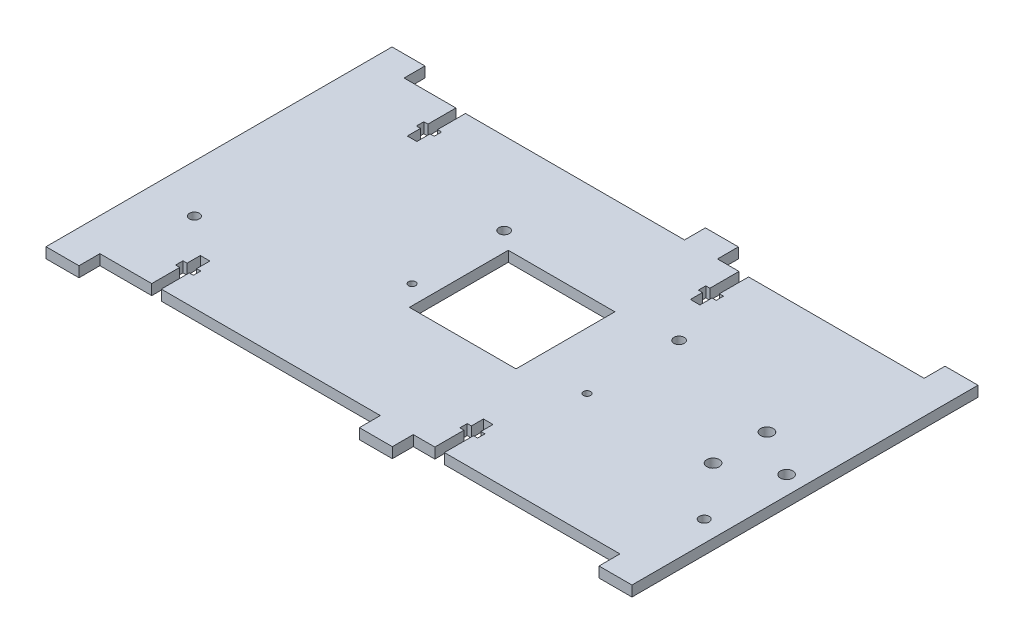
from build123d import *

# Parameters (mm, degrees)
SKETCH1_R      = 1.9
SKETCH1_R_2    = 1.58353158
SKETCH1_R_3    = 1.50705101
SKETCH1_R_4    = 1.0795
SKETCH1_W      = 32.345315457
SKETCH1_H      = 30
EXTRUDE1_DEPTH = 3.175


with BuildPart() as part:
    # Sketch1 → Extrude1 (new body)
    with BuildSketch(Plane(origin=(0, 0, 0), x_dir=(1, 0, 0), z_dir=(0, 1, 0))):
        Polygon((-67.158636898, 70.484310302), (-67.158636898, 74.492800404), (-68.408636898, 74.492800404), (-68.408636898, 76.742800404), (-67.158636898, 76.742800404), (-67.158636898, 85.234310302), (-82.88813161, 85.234310302), (-82.88813161, 91.584310302), (-92.88813161, 91.584310302), (-92.88813161, -13.415689698), (-82.88813161, -13.415689698), (-82.88813161, -7.065689698), (-67.158636898, -7.065689698), (-67.158636898, 1.425820201), (-68.408636898, 1.425820201), (-68.408636898, 3.675820201), (-67.158636898, 3.675820201), (-67.158636898, 7.684310302), (-64.258636898, 7.684310302), (-64.258636898, 3.675820201), (-63.008636898, 3.675820201), (-63.008636898, 1.425820201), (-64.258636898, 1.425820201), (-64.258636898, -7.065689698), (2.20186839, -7.065689698), (2.20186839, -13.415689698), (12.20186839, -13.415689698), (12.20186839, -7.065689698), (18.744143558, -7.065689698), (18.744143558, 1.771032224), (17.494143558, 1.771032224), (17.494143558, 4.021032224), (18.744143558, 4.021032224), (18.744143558, 7.684310302), (21.644143558, 7.684310302), (21.644143558, 4.021032224), (22.894143558, 4.021032224), (22.894143558, 1.771032224), (21.644143558, 1.771032224), (21.644143558, -7.065689698), (74.914143558, -7.065689698), (74.914143558, -13.415689698), (84.914143558, -13.415689698), (84.914143558, 91.584310302), (74.914143558, 91.584310302), (74.914143558, 85.234310302), (21.644143558, 85.234310302), (21.644143558, 76.397588381), (22.894143558, 76.397588381), (22.894143558, 74.147588381), (21.644143558, 74.147588381), (21.644143558, 70.484310302), (18.744143558, 70.484310302), (18.744143558, 74.147588381), (17.494143558, 74.147588381), (17.494143558, 76.397588381), (18.744143558, 76.397588381), (18.744143558, 85.234310302), (12.20186839, 85.234310302), (12.20186839, 91.584310302), (2.20186839, 91.584310302), (2.20186839, 85.234310302), (-64.258636898, 85.234310302), (-64.258636898, 76.742800404), (-63.008636898, 76.742800404), (-63.008636898, 74.492800404), (-64.258636898, 74.492800404), (-64.258636898, 70.484310302), align=None)
        with Locations(Location((79.354143558, 39.084310302, 0), (0, 0, 270))):
            Circle(SKETCH1_R, mode=Mode.SUBTRACT)
        with Locations(Location((65.194143558, 30.909030491, 0), (0, 0, 270))):
            Circle(SKETCH1_R, mode=Mode.SUBTRACT)
        with Locations(Location((65.194143558, 47.259590114, 0), (0, 0, 270))):
            Circle(SKETCH1_R, mode=Mode.SUBTRACT)
        with Locations(Location((27.777428137, 58.025608002, 0), (0, 0, 270))):
            Circle(SKETCH1_R_2, mode=Mode.SUBTRACT)
        with Locations(Location((78.577377337, 14.845608002, 0), (0, 0, 270))):
            Circle(SKETCH1_R_3, mode=Mode.SUBTRACT)
        with Locations(Location((27.777428137, 30.085608002, 0), (0, 0, 270))):
            Circle(SKETCH1_R_4, mode=Mode.SUBTRACT)
        with Locations(Location((-78.42302428, 17.147481819, 0), (0, 0, 270))):
            Circle(SKETCH1_R_3, mode=Mode.SUBTRACT)
        with Locations(Location((-27.62307508, 32.387481819, 0), (0, 0, 270))):
            Circle(SKETCH1_R_4, mode=Mode.SUBTRACT)
        with Locations(Location((-27.62307508, 60.327481819, 0), (0, 0, 270))):
            Circle(SKETCH1_R_2, mode=Mode.SUBTRACT)
        with Locations((-5.646064502, 40.784310302)):
            Rectangle(SKETCH1_W, SKETCH1_H, mode=Mode.SUBTRACT)
    extrude(amount=EXTRUDE1_DEPTH)


solid = part.part
